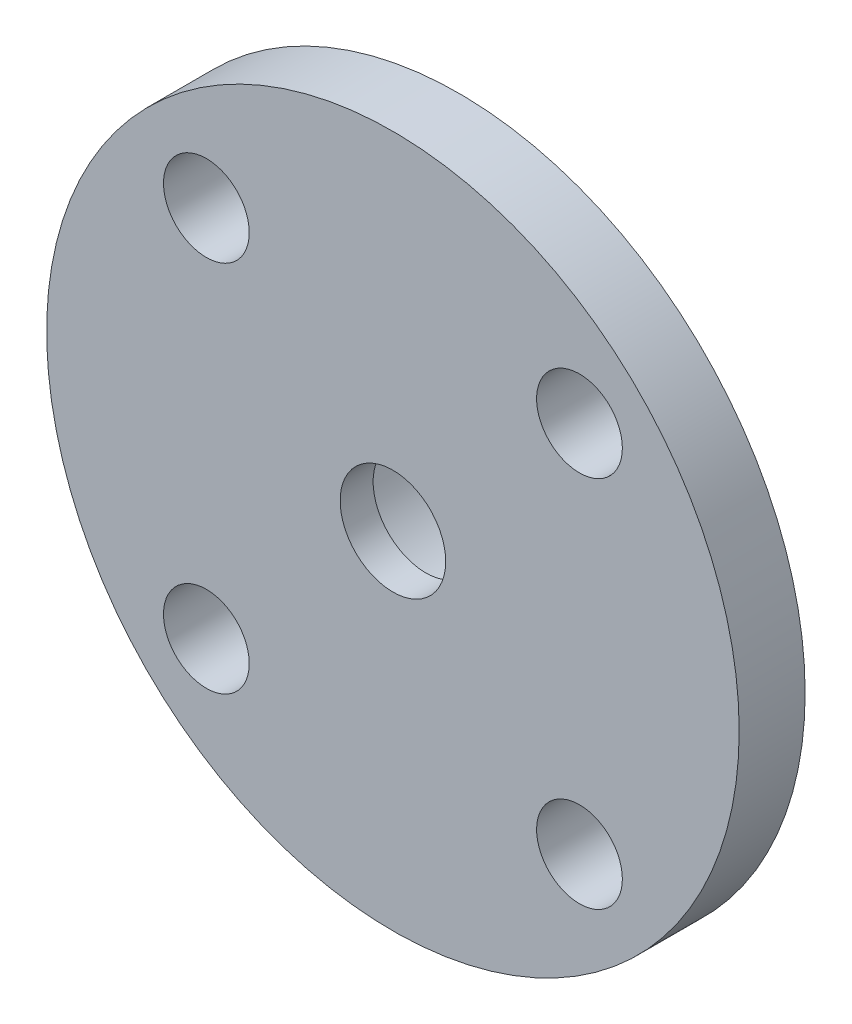
from build123d import *

# Parameters (mm, degrees)
SKETCH_2_R               = 2.6
CUT_EXTRUDE_1_DEPTH      = 4
PATTERN_CIRCULAR_1_COUNT = 4


with BuildPart() as part:
    # Эскиз1 → Повернуть1 (revolve)
    with BuildSketch(Plane(origin=(0, 0, 0), x_dir=(1, 0, 0), z_dir=(0, 1, 0)), mode=Mode.PRIVATE) as revolve_1_sk:
        Polygon((-3.2, 0), (-21, 0), (-21, 4), (-9.5, 4), (-9.5, 7.8), (-6, 7.8), (-6, 2), (-3.2, 2), align=None)
    revolve(revolve_1_sk.sketch.rotate(Axis((0, 0, 0), (0, 0, -1)), 180), axis=Axis((0, 0, 0), (0, 0, -1)))

    # Эскиз2 → Вырез-Вытянуть1 (cut)
    with BuildSketch(Plane.XY):
        with Locations((11.313708499, 11.313708499)):
            Circle(SKETCH_2_R)
    cut_extrude_1 = extrude(amount=-CUT_EXTRUDE_1_DEPTH, mode=Mode.SUBTRACT)

    # Круговой массив1: Вырез-Вытянуть1 ×4 about axis
    pattern_circular_1_axis = Axis((0, 0, 0), (0, 0, 1))
    for i in range(1, PATTERN_CIRCULAR_1_COUNT):
        add(cut_extrude_1.rotate(pattern_circular_1_axis, i * 360 / PATTERN_CIRCULAR_1_COUNT), mode=Mode.SUBTRACT)


solid = part.part
